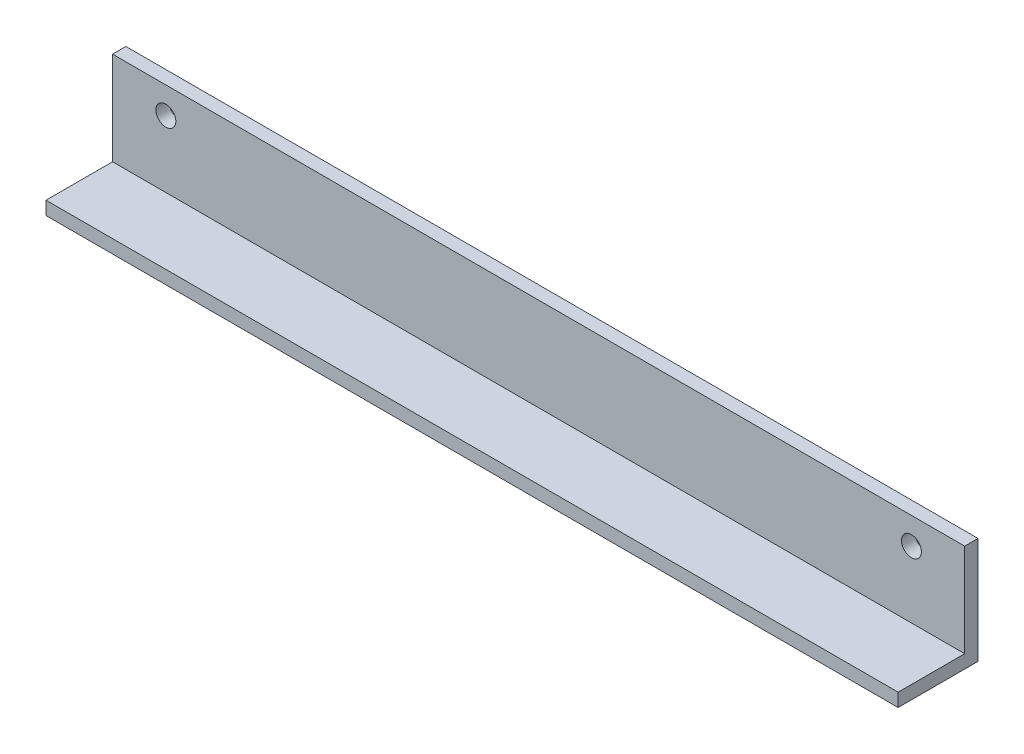
from build123d import *

# Parameters (mm, degrees)
EXTRUDE_THIN1_DEPTH          = 203.2
F_3_8_0_375_DIAMETER_HOLE1_D = 9.525


with BuildPart() as part:
    # Sketch1 → Extrude-Thin1 (new, symmetric)
    with BuildSketch(Plane(origin=(0, 0, 0), x_dir=(0, 0, -1), z_dir=(1, 0, 0))):
        Polygon((-38.1, 0), (0, 0), (0, 50.8), (-6.35, 50.8), (-6.35, 6.35), (-38.1, 6.35), align=None)
    extrude(amount=EXTRUDE_THIN1_DEPTH, both=True)

    # 3/8 (0.375) Diameter Hole1 (through all)
    with Locations(Plane.XY.offset(6.35)):
        with Locations((-177.8, 38.1), (177.8, 38.1)):
            Hole(F_3_8_0_375_DIAMETER_HOLE1_D / 2)


solid = part.part
